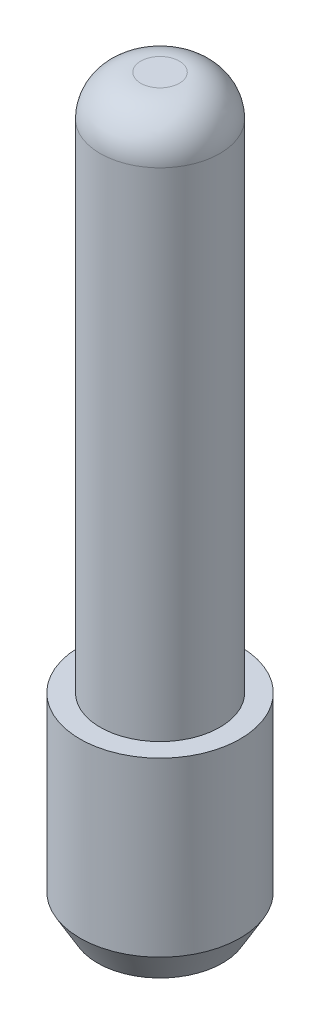
from build123d import *

# Parameters (mm, degrees)
FILLET1_R      = 2
CHAMFER2_SIZE  = 1.5
CHAMFER2_SIZE2 = 0.866025404


with BuildPart() as part:
    # Sketch4 → Revolve1 (revolve)
    with BuildSketch(Plane.XY, mode=Mode.PRIVATE) as revolve1_sk:
        Polygon((0, 0), (3.95, 0), (3.95, 10), (2.95, 10), (2.95, 36.5), (0, 36.5), align=None)
    revolve(revolve1_sk.sketch.rotate(Axis((0, 0, 0), (0, 1, 0)), 90), axis=Axis((0, 0, 0), (0, 1, 0)))

    # Fillet1
    fillet1_edges = [part.edges().sort_by_distance(p)[0] for p in [
        (0, 36.5, 2.95),
    ]]
    fillet(fillet1_edges, radius=FILLET1_R)

    # Chamfer2
    chamfer2_edges = [part.edges().sort_by_distance(p)[0] for p in [
        (0, 0, 3.95),
    ]]
    chamfer2_side = [part.faces().sort_by_distance(p)[0] for p in [
        (0, 5, 3.95),
    ]]
    chamfer(chamfer2_edges, length=CHAMFER2_SIZE, length2=CHAMFER2_SIZE2, reference=chamfer2_side[0])


solid = part.part
